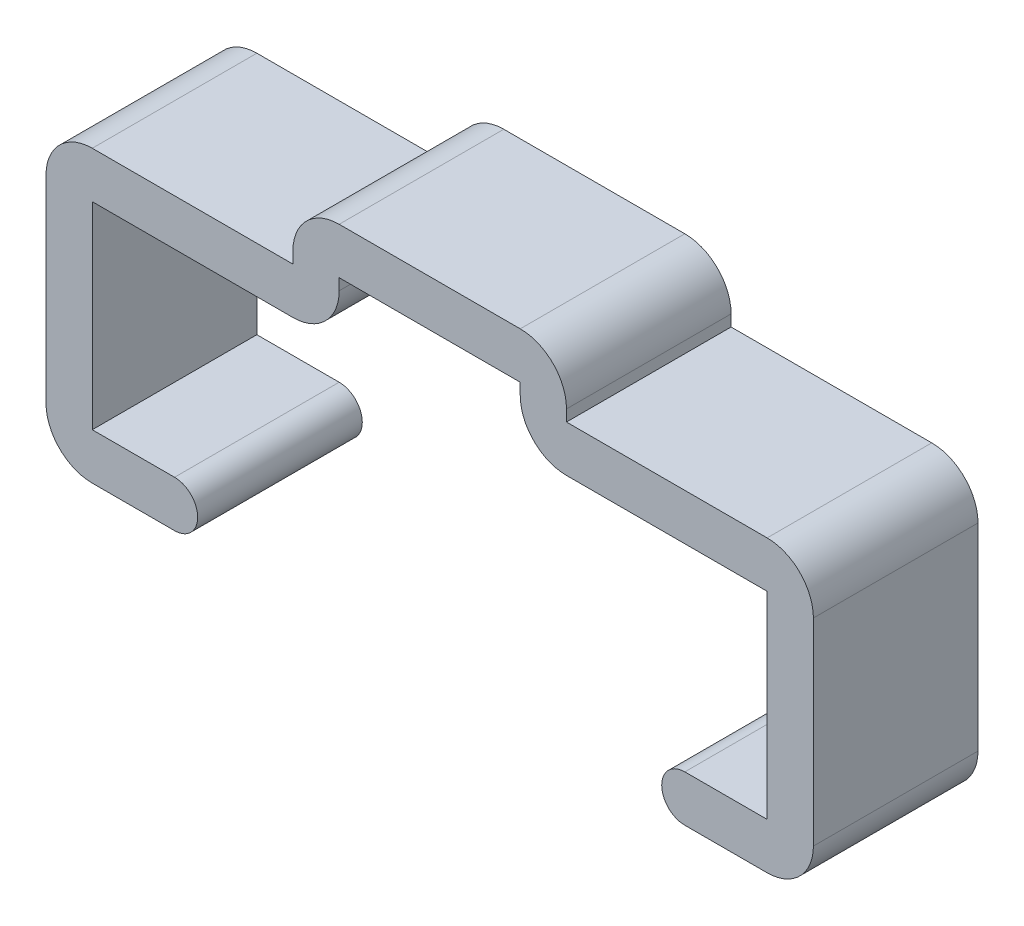
from build123d import *

# Parameters (mm, degrees)
BOSS_EXTRUDE1_DEPTH = 10


with BuildPart() as part:
    # Sketch1 → Boss-Extrude1 (new body)
    with BuildSketch(Plane.XY):
        with BuildLine():
            Line((-20.5, -6), (-15.5, -6))
            ThreePointArc((-15.5, -6), (-14.095, -7.405), (-15.5, -8.81))
            Line((-15.5, -8.81), (-20.5, -8.81))
            ThreePointArc((-20.5, -8.81), (-22.486970055, -7.986970055), (-23.31, -6))
            Line((-23.31, -6), (-23.31, 6))
            ThreePointArc((-23.31, 6), (-22.486970055, 7.986970055), (-20.5, 8.81))
            Line((-20.5, 8.81), (-8.31, 8.81))
            Line((-8.31, 8.81), (-8.31, 9.5))
            ThreePointArc((-8.31, 9.5), (-7.486970055, 11.486970055), (-5.5, 12.31))
            Line((-5.5, 12.31), (5.5, 12.31))
            ThreePointArc((5.5, 12.31), (7.486970055, 11.486970055), (8.31, 9.5))
            Line((8.31, 9.5), (8.31, 8.81))
            Line((8.31, 8.81), (20.5, 8.81))
            ThreePointArc((20.5, 8.81), (22.486970055, 7.986970055), (23.31, 6))
            Line((23.31, 6), (23.31, -6))
            ThreePointArc((23.31, -6), (22.486970055, -7.986970055), (20.5, -8.81))
            Line((20.5, -8.81), (15.5, -8.81))
            ThreePointArc((15.5, -8.81), (14.095, -7.405), (15.5, -6))
            Line((15.5, -6), (20.5, -6))
            Line((20.5, -6), (20.5, 6))
            Line((20.5, 6), (8.31, 6))
            ThreePointArc((8.31, 6), (6.323029945, 6.823029945), (5.5, 8.81))
            Line((5.5, 8.81), (5.5, 9.5))
            Line((5.5, 9.5), (-5.5, 9.5))
            Line((-5.5, 9.5), (-5.5, 8.81))
            ThreePointArc((-5.5, 8.81), (-6.323029945, 6.823029945), (-8.31, 6))
            Line((-8.31, 6), (-20.5, 6))
            Line((-20.5, 6), (-20.5, -6))
        make_face()
    extrude(amount=BOSS_EXTRUDE1_DEPTH)


solid = part.part
